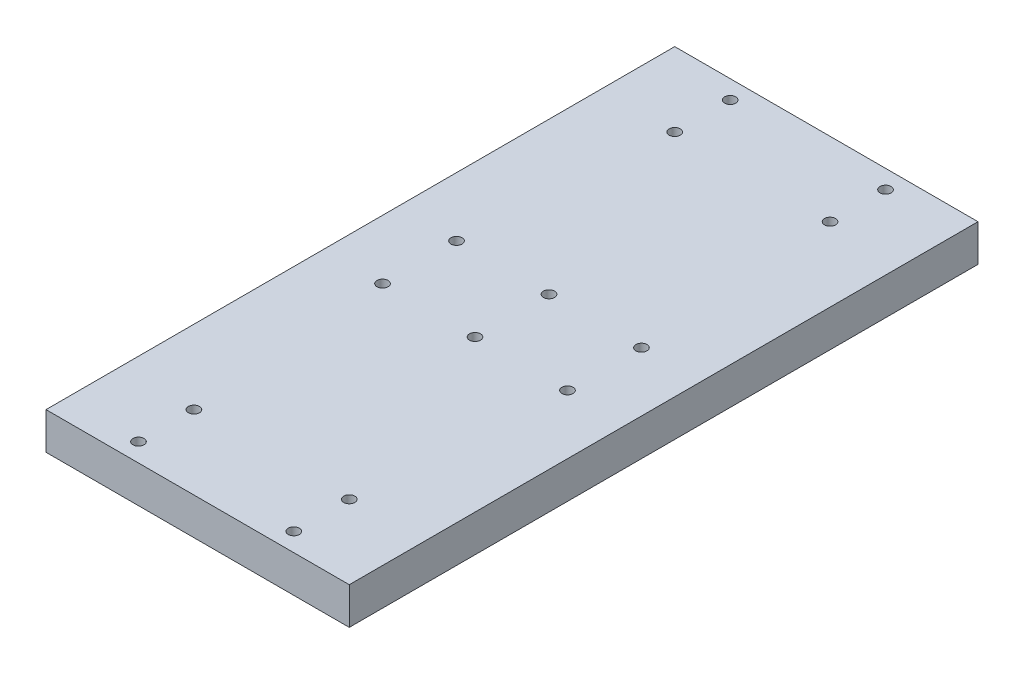
from build123d import *

# Parameters (mm, degrees)
SKETCH_1_W               = 82
SKETCH_1_H               = 170
EXTRUDE_1_DEPTH          = 10
SKETCH_2_R               = 1.5
CUT_EXTRUDE_1_DEPTH      = 95.899947313
SKETCH_3_R               = 1.5
CUT_EXTRUDE_2_DEPTH      = 10
MIRROR_2_COPY_1_SKETCH_R = 1.5
MIRROR_2_COPY_1_DEPTH    = 10


with BuildPart() as part:
    # 草图1 → 凸台-拉伸1 (new body)
    with BuildSketch(Plane(origin=(0, 0, 0), x_dir=(1, 0, 0), z_dir=(0, 1, 0))):
        Rectangle(SKETCH_1_W, SKETCH_1_H)
    extrude(amount=EXTRUDE_1_DEPTH)

    # 草图2 → 切除-拉伸1 (cut, through all)
    with BuildSketch(Plane(origin=(0, 10, 0), x_dir=(1, 0, 0), z_dir=(0, 1, 0))):
        with Locations(Location((-25, 10, 0), (0, 0, 270))):
            Circle(SKETCH_2_R)
        with Locations(Location((0, 10, 0), (0, 0, 270))):
            Circle(SKETCH_2_R)
        with Locations(Location((25, 10, 0), (0, 0, 270))):
            Circle(SKETCH_2_R)
        with Locations(Location((-25, -10, 0), (0, 0, 270))):
            Circle(SKETCH_2_R)
        with Locations(Location((0, -10, 0), (0, 0, 270))):
            Circle(SKETCH_2_R)
        with Locations(Location((25, -10, 0), (0, 0, 270))):
            Circle(SKETCH_2_R)
    extrude(amount=-CUT_EXTRUDE_1_DEPTH, mode=Mode.SUBTRACT)

    # 草图3 → 切除-拉伸2 (cut)
    with BuildSketch(Plane.XZ):
        with Locations(Location((-21, 80, 0), (0, 0, 270))):
            Circle(SKETCH_3_R)
        with Locations(Location((-21, 65, 0), (0, 0, 270))):
            Circle(SKETCH_3_R)
    cut_extrude_2 = extrude(amount=-CUT_EXTRUDE_2_DEPTH, mode=Mode.SUBTRACT)

    # 镜向1: 切除-拉伸2 across plane
    add(cut_extrude_2.mirror(Plane.XY), mode=Mode.SUBTRACT)

    # 镜向2: 切除-拉伸2 across plane
    add(cut_extrude_2.mirror(Plane(origin=(0, 0, 0), x_dir=(0, 0, 1), z_dir=(1, 0, 0))), mode=Mode.SUBTRACT)

    # 镜向2 copy 1 sketch → 镜向2 copy 1 (cut)
    with BuildSketch(Plane(origin=(0, 0, 0), x_dir=(-1, 0, 0), z_dir=(0, -1, 0))):
        with Locations(Location((-21, 80, 0), (0, 0, 270))):
            Circle(MIRROR_2_COPY_1_SKETCH_R)
        with Locations(Location((-21, 65, 0), (0, 0, 270))):
            Circle(MIRROR_2_COPY_1_SKETCH_R)
    extrude(amount=-MIRROR_2_COPY_1_DEPTH, mode=Mode.SUBTRACT)


solid = part.part
